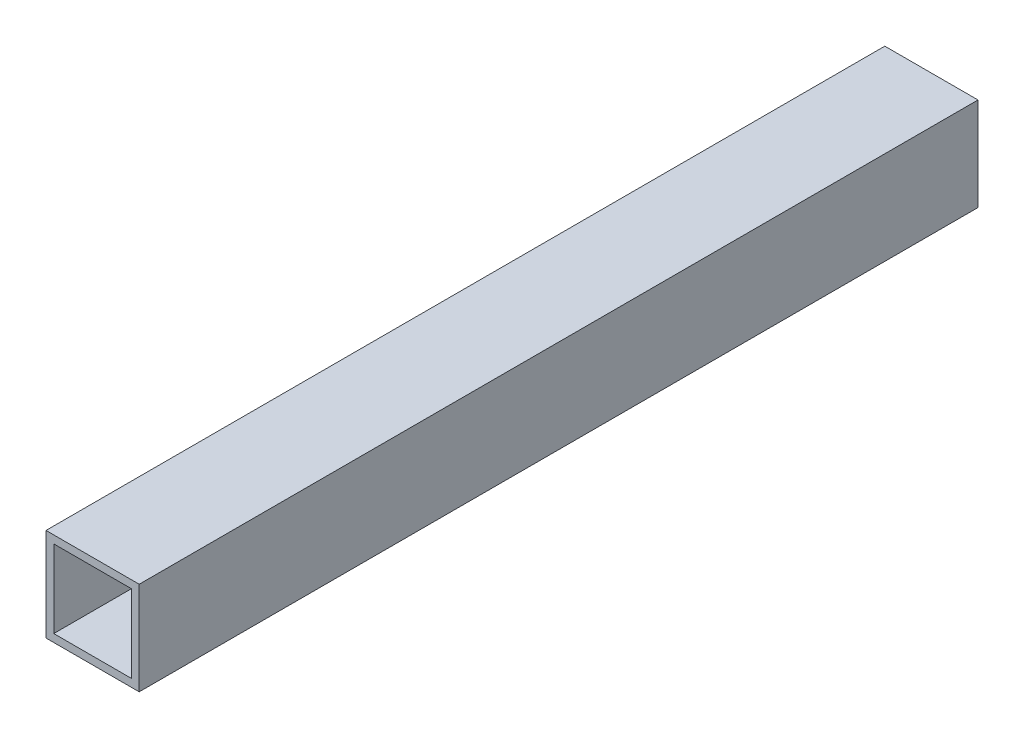
from build123d import *

# Parameters (mm, degrees)
SKETCH_1_W      = 24
SKETCH_1_H      = 24
SKETCH_1_W_2    = 20
SKETCH_1_H_2    = 20
EXTRUDE_1_DEPTH = 108


with BuildPart() as part:
    # 草图1 → 凸台-拉伸1 (new, symmetric)
    with BuildSketch(Plane.XY):
        Rectangle(SKETCH_1_W, SKETCH_1_H)
        Rectangle(SKETCH_1_W_2, SKETCH_1_H_2, mode=Mode.SUBTRACT)
    extrude(amount=EXTRUDE_1_DEPTH, both=True)


solid = part.part
